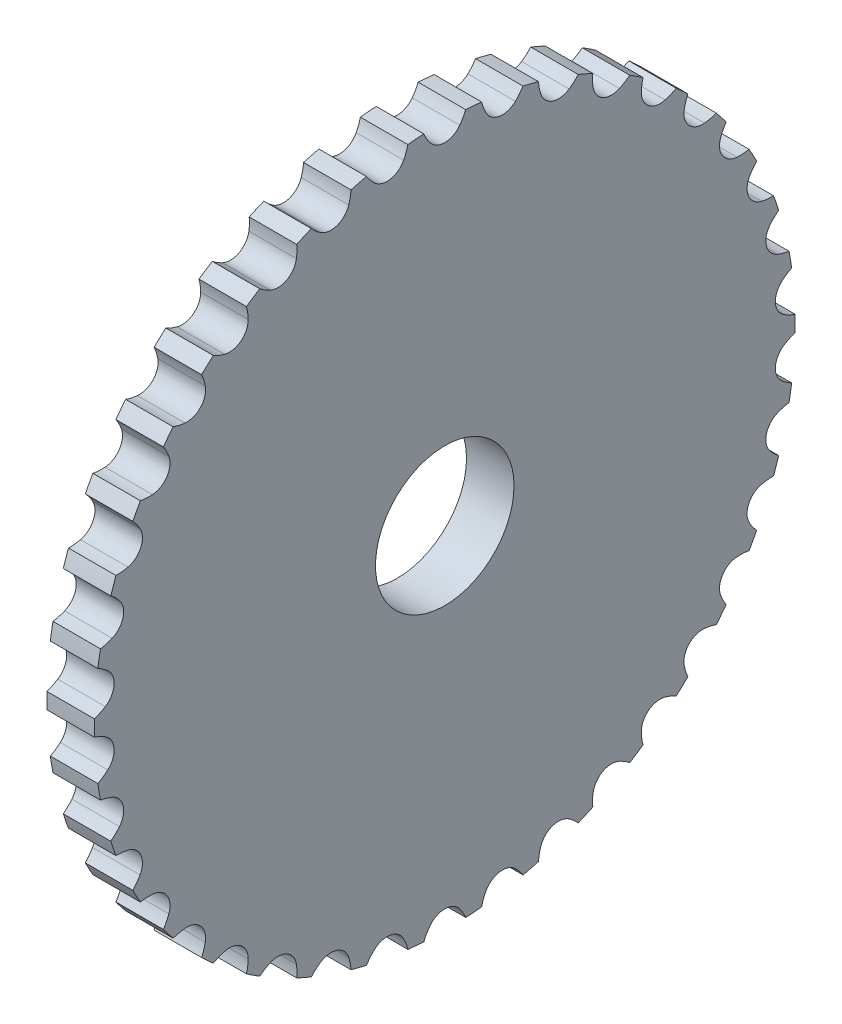
from build123d import *

# Parameters (mm, degrees)
BOSS_EXTRUDE1_DEPTH = 13.030962
SKETCH2_R           = 19
CUT_EXTRUDE1_DEPTH  = 137.435285608


with BuildPart() as part:
    # Sketch1 → Boss-Extrude1 (new body)
    with BuildSketch(Plane(origin=(0, 0, 0), x_dir=(0, 0, -1), z_dir=(1, 0, 0))):
        with BuildLine():
            ThreePointArc((10.112245638, 95.586160258), (7.937491095, 95.79127194), (5.758637096, 95.946910547))
            ThreePointArc((5.758637096, 95.946910547), (5.025601702, 94.455780837), (4.111990682, 93.067932285))
            ThreePointArc((4.111990682, 93.067932285), (0, 90.998929), (-4.111990682, 93.067932285))
            ThreePointArc((-4.111990682, 93.067932285), (-5.025601702, 94.455780837), (-5.758637096, 95.946910547))
            ThreePointArc((-5.758637096, 95.946910547), (-7.937491095, 95.79127194), (-10.112245638, 95.586160258))
            ThreePointArc((-10.112245638, 95.586160258), (-10.589851501, 93.994713954), (-11.262569694, 92.475418415))
            ThreePointArc((-11.262569694, 92.475418415), (-14.977931435, 89.757822217), (-19.374386671, 91.121795572))
            ThreePointArc((-19.374386671, 91.121795572), (-20.503969592, 92.340340247), (-21.472439222, 93.690479231))
            ThreePointArc((-21.472439222, 93.690479231), (-23.59595922, 93.178335751), (-25.707292672, 92.618068692))
            ThreePointArc((-25.707292672, 92.618068692), (-25.916441161, 90.969716299), (-26.329916528, 89.360416196))
            ThreePointArc((-26.329916528, 89.360416196), (-29.547303944, 86.068356024), (-34.108299898, 86.690093813))
            ThreePointArc((-34.108299898, 86.690093813), (-35.423042641, 87.706095889), (-36.600529181, 88.878415875))
            ThreePointArc((-36.600529181, 88.878415875), (-38.610791087, 88.02373746), (-40.601111776, 87.123597649))
            ThreePointArc((-40.601111776, 87.123597649), (-40.536097865, 85.463301925), (-40.679051876, 83.807894769))
            ThreePointArc((-40.679051876, 83.807894769), (-43.310703027, 80.031169443), (-47.911827616, 79.893712278))
            ThreePointArc((-47.911827616, 79.893712278), (-49.375867428, 80.679457867), (-50.730252113, 81.641981022))
            ThreePointArc((-50.730252113, 81.641981022), (-52.572421224, 80.468081072), (-54.38743839, 79.252621976))
            ThreePointArc((-54.38743839, 79.252621976), (-54.05003549, 77.62567146), (-53.918568732, 75.969312443))
            ThreePointArc((-53.918568732, 75.969312443), (-55.892699033, 71.810941186), (-60.408445575, 70.91803854))
            ThreePointArc((-60.408445575, 70.91803854), (-61.981847265, 71.452094551), (-63.476186013, 72.178565752))
            ThreePointArc((-63.476186013, 72.178565752), (-65.100012756, 70.717465197), (-66.690217462, 69.219841372))
            ThreePointArc((-66.690217462, 69.219841372), (-66.089629044, 67.670615032), (-65.687327587, 66.058485311))
            ThreePointArc((-65.687327587, 66.058485311), (-66.950087911, 61.631897649), (-71.257278611, 60.007905581))
            ThreePointArc((-71.257278611, 60.007905581), (-72.897123883, 60.275704356), (-74.490655028, 60.746307364))
            ThreePointArc((-74.490655028, 60.746307364), (-75.851845644, 59.037861218), (-77.17386125, 57.298923938))
            ThreePointArc((-77.17386125, 57.298923938), (-76.3264698, 55.869680631), (-75.66430738, 54.345754901))
            ThreePointArc((-75.66430738, 54.345754901), (-76.181252917, 49.771696608), (-80.16239884, 47.460913386))
            ThreePointArc((-80.16239884, 47.460913386), (-81.82395699, 47.455150074), (-83.473213156, 47.657048064))
            ThreePointArc((-83.473213156, 47.657048064), (-84.534637913, 45.747858285), (-85.55240328, 43.815041227))
            ThreePointArc((-85.55240328, 43.815041227), (-84.481323429, 42.544766984), (-83.57736211, 41.150613967))
            ThreePointArc((-83.57736211, 41.150613967), (-83.334391932, 36.553853428), (-86.880897797, 33.619311195))
            ThreePointArc((-86.880897797, 33.619311195), (-88.518845849, 33.340143005), (-90.178839628, 33.267828726))
            ThreePointArc((-90.178839628, 33.267828726), (-90.911545625, 31.209973034), (-91.597298768, 29.135998408))
            ThreePointArc((-91.597298768, 29.135998408), (-90.331746781, 28.059342999), (-89.210644272, 26.832991555))
            ThreePointArc((-89.210644272, 26.832991555), (-88.214385973, 22.338916415), (-91.229512343, 18.860661833))
            ThreePointArc((-91.229512343, 18.860661833), (-92.799171345, 18.315703745), (-94.424622433, 17.971149743))
            ThreePointArc((-94.424622433, 17.971149743), (-94.808623361, 15.820761077), (-95.143658721, 13.662201504))
            ThreePointArc((-95.143658721, 13.662201504), (-93.718155558, 12.808533282), (-92.410492612, 11.783435082))
            ThreePointArc((-92.410492612, 11.783435082), (-90.688121522, 7.514631995), (-93.08962361, 3.587542783))
            ThreePointArc((-93.08962361, 3.587542783), (-94.548177356, 2.791659833), (-96.094747685, 2.184264642))
            ThreePointArc((-96.094747685, 2.184264642), (-96.119569, 0), (-96.094747685, -2.184264642))
            ThreePointArc((-96.094747685, -2.184264642), (-94.548177356, -2.791659833), (-93.08962361, -3.587542783))
            ThreePointArc((-93.08962361, -3.587542783), (-90.688121522, -7.514631996), (-92.410492612, -11.783435082))
            ThreePointArc((-92.410492612, -11.783435082), (-93.718155558, -12.808533282), (-95.143658721, -13.662201504))
            ThreePointArc((-95.143658721, -13.662201504), (-94.808623361, -15.820761078), (-94.424622433, -17.971149743))
            ThreePointArc((-94.424622433, -17.971149743), (-92.799171345, -18.315703745), (-91.229512343, -18.860661833))
            ThreePointArc((-91.229512343, -18.860661833), (-88.214385973, -22.338916415), (-89.210644272, -26.832991555))
            ThreePointArc((-89.210644272, -26.832991555), (-90.331746781, -28.059342999), (-91.597298768, -29.135998408))
            ThreePointArc((-91.597298768, -29.135998408), (-90.911545625, -31.209973035), (-90.178839628, -33.267828726))
            ThreePointArc((-90.178839628, -33.267828726), (-88.518845849, -33.340143005), (-86.880897797, -33.619311195))
            ThreePointArc((-86.880897797, -33.619311195), (-83.334391932, -36.553853428), (-83.57736211, -41.150613967))
            ThreePointArc((-83.57736211, -41.150613967), (-84.481323429, -42.544766984), (-85.55240328, -43.815041227))
            ThreePointArc((-85.55240328, -43.815041227), (-84.534637913, -45.747858285), (-83.473213156, -47.657048064))
            ThreePointArc((-83.473213156, -47.657048064), (-81.82395699, -47.455150074), (-80.16239884, -47.460913386))
            ThreePointArc((-80.16239884, -47.460913386), (-76.181252917, -49.771696608), (-75.66430738, -54.345754901))
            ThreePointArc((-75.66430738, -54.345754901), (-76.3264698, -55.869680631), (-77.17386125, -57.298923939))
            ThreePointArc((-77.17386125, -57.298923939), (-75.851845644, -59.037861218), (-74.490655027, -60.746307364))
            ThreePointArc((-74.490655027, -60.746307364), (-72.897123883, -60.275704356), (-71.257278611, -60.007905581))
            ThreePointArc((-71.257278611, -60.007905581), (-66.950087911, -61.631897649), (-65.687327587, -66.058485311))
            ThreePointArc((-65.687327587, -66.058485311), (-66.089629044, -67.670615033), (-66.690217462, -69.219841372))
            ThreePointArc((-66.690217462, -69.219841372), (-65.100012756, -70.717465197), (-63.476186013, -72.178565752))
            ThreePointArc((-63.476186013, -72.178565752), (-61.981847265, -71.452094551), (-60.408445575, -70.91803854))
            ThreePointArc((-60.408445575, -70.91803854), (-55.892699033, -71.810941186), (-53.918568732, -75.969312443))
            ThreePointArc((-53.918568732, -75.969312443), (-54.05003549, -77.62567146), (-54.38743839, -79.252621976))
            ThreePointArc((-54.38743839, -79.252621976), (-52.572421224, -80.468081072), (-50.730252113, -81.641981022))
            ThreePointArc((-50.730252113, -81.641981022), (-49.375867428, -80.679457867), (-47.911827616, -79.893712278))
            ThreePointArc((-47.911827616, -79.893712278), (-43.310703027, -80.031169443), (-40.679051876, -83.807894769))
            ThreePointArc((-40.679051876, -83.807894769), (-40.536097865, -85.463301925), (-40.601111776, -87.123597649))
            ThreePointArc((-40.601111776, -87.123597649), (-38.610791087, -88.02373746), (-36.60052918, -88.878415875))
            ThreePointArc((-36.60052918, -88.878415875), (-35.423042641, -87.706095889), (-34.108299898, -86.690093813))
            ThreePointArc((-34.108299898, -86.690093813), (-29.547303944, -86.068356024), (-26.329916528, -89.360416196))
            ThreePointArc((-26.329916528, -89.360416196), (-25.916441161, -90.969716299), (-25.707292672, -92.618068692))
            ThreePointArc((-25.707292672, -92.618068692), (-23.59595922, -93.178335751), (-21.472439222, -93.690479231))
            ThreePointArc((-21.472439222, -93.690479231), (-20.503969592, -92.340340247), (-19.374386671, -91.121795572))
            ThreePointArc((-19.374386671, -91.121795572), (-14.977931435, -89.757822217), (-11.262569694, -92.475418415))
            ThreePointArc((-11.262569694, -92.475418415), (-10.589851501, -93.994713954), (-10.112245638, -95.586160258))
            ThreePointArc((-10.112245638, -95.586160258), (-7.937491095, -95.79127194), (-5.758637096, -95.946910547))
            ThreePointArc((-5.758637096, -95.946910547), (-5.025601702, -94.455780837), (-4.111990682, -93.067932285))
            ThreePointArc((-4.111990682, -93.067932285), (0, -90.998929), (4.111990682, -93.067932285))
            ThreePointArc((4.111990682, -93.067932285), (5.025601703, -94.455780837), (5.758637096, -95.946910547))
            ThreePointArc((5.758637096, -95.946910547), (7.937491095, -95.79127194), (10.112245639, -95.586160258))
            ThreePointArc((10.112245639, -95.586160258), (10.589851501, -93.994713954), (11.262569694, -92.475418415))
            ThreePointArc((11.262569694, -92.475418415), (14.977931435, -89.757822217), (19.374386671, -91.121795572))
            ThreePointArc((19.374386671, -91.121795572), (20.503969592, -92.340340247), (21.472439222, -93.690479231))
            ThreePointArc((21.472439222, -93.690479231), (23.59595922, -93.178335751), (25.707292673, -92.618068692))
            ThreePointArc((25.707292673, -92.618068692), (25.916441161, -90.969716299), (26.329916528, -89.360416196))
            ThreePointArc((26.329916528, -89.360416196), (29.547303945, -86.068356024), (34.108299898, -86.690093813))
            ThreePointArc((34.108299898, -86.690093813), (35.423042641, -87.706095889), (36.600529181, -88.878415875))
            ThreePointArc((36.600529181, -88.878415875), (38.610791087, -88.02373746), (40.601111776, -87.123597649))
            ThreePointArc((40.601111776, -87.123597649), (40.536097865, -85.463301925), (40.679051876, -83.807894769))
            ThreePointArc((40.679051876, -83.807894769), (43.310703027, -80.031169443), (47.911827616, -79.893712278))
            ThreePointArc((47.911827616, -79.893712278), (49.375867428, -80.679457867), (50.730252113, -81.641981022))
            ThreePointArc((50.730252113, -81.641981022), (52.572421224, -80.468081072), (54.38743839, -79.252621976))
            ThreePointArc((54.38743839, -79.252621976), (54.05003549, -77.62567146), (53.918568732, -75.969312443))
            ThreePointArc((53.918568732, -75.969312443), (55.892699033, -71.810941186), (60.408445575, -70.91803854))
            ThreePointArc((60.408445575, -70.91803854), (61.981847265, -71.452094551), (63.476186013, -72.178565752))
            ThreePointArc((63.476186013, -72.178565752), (65.100012756, -70.717465197), (66.690217462, -69.219841372))
            ThreePointArc((66.690217462, -69.219841372), (66.089629044, -67.670615032), (65.687327587, -66.058485311))
            ThreePointArc((65.687327587, -66.058485311), (66.950087911, -61.631897649), (71.257278611, -60.007905581))
            ThreePointArc((71.257278611, -60.007905581), (72.897123883, -60.275704356), (74.490655028, -60.746307364))
            ThreePointArc((74.490655028, -60.746307364), (75.851845644, -59.037861218), (77.17386125, -57.298923938))
            ThreePointArc((77.17386125, -57.298923938), (76.3264698, -55.869680631), (75.66430738, -54.345754901))
            ThreePointArc((75.66430738, -54.345754901), (76.181252917, -49.771696608), (80.16239884, -47.460913386))
            ThreePointArc((80.16239884, -47.460913386), (81.82395699, -47.455150074), (83.473213156, -47.657048064))
            ThreePointArc((83.473213156, -47.657048064), (84.534637913, -45.747858285), (85.55240328, -43.815041227))
            ThreePointArc((85.55240328, -43.815041227), (84.481323429, -42.544766984), (83.57736211, -41.150613967))
            ThreePointArc((83.57736211, -41.150613967), (83.334391932, -36.553853428), (86.880897797, -33.619311195))
            ThreePointArc((86.880897797, -33.619311195), (88.518845849, -33.340143005), (90.178839628, -33.267828726))
            ThreePointArc((90.178839628, -33.267828726), (90.911545625, -31.209973034), (91.597298768, -29.135998408))
            ThreePointArc((91.597298768, -29.135998408), (90.331746781, -28.059342999), (89.210644272, -26.832991555))
            ThreePointArc((89.210644272, -26.832991555), (88.214385973, -22.338916415), (91.229512343, -18.860661833))
            ThreePointArc((91.229512343, -18.860661833), (92.799171345, -18.315703745), (94.424622433, -17.971149743))
            ThreePointArc((94.424622433, -17.971149743), (94.808623361, -15.820761077), (95.143658721, -13.662201504))
            ThreePointArc((95.143658721, -13.662201504), (93.718155558, -12.808533282), (92.410492612, -11.783435082))
            ThreePointArc((92.410492612, -11.783435082), (90.688121522, -7.514631995), (93.089623611, -3.587542783))
            ThreePointArc((93.089623611, -3.587542783), (94.548177356, -2.791659833), (96.094747685, -2.184264642))
            ThreePointArc((96.094747685, -2.184264642), (96.113363471, -1.092202834), (96.119569, 0))
            ThreePointArc((96.119569, 0), (96.113363471, 1.092202834), (96.094747685, 2.184264642))
            ThreePointArc((96.094747685, 2.184264642), (94.548177356, 2.791659833), (93.089623611, 3.587542783))
            ThreePointArc((93.089623611, 3.587542783), (90.688121522, 7.514631996), (92.410492612, 11.783435082))
            ThreePointArc((92.410492612, 11.783435082), (93.718155558, 12.808533282), (95.143658721, 13.662201504))
            ThreePointArc((95.143658721, 13.662201504), (94.808623361, 15.820761078), (94.424622433, 17.971149743))
            ThreePointArc((94.424622433, 17.971149743), (92.799171345, 18.315703745), (91.229512343, 18.860661833))
            ThreePointArc((91.229512343, 18.860661833), (88.214385973, 22.338916415), (89.210644272, 26.832991555))
            ThreePointArc((89.210644272, 26.832991555), (90.331746781, 28.059342999), (91.597298768, 29.135998408))
            ThreePointArc((91.597298768, 29.135998408), (90.911545625, 31.209973034), (90.178839628, 33.267828726))
            ThreePointArc((90.178839628, 33.267828726), (88.518845849, 33.340143005), (86.880897797, 33.619311195))
            ThreePointArc((86.880897797, 33.619311195), (83.334391932, 36.553853428), (83.57736211, 41.150613967))
            ThreePointArc((83.57736211, 41.150613967), (84.481323429, 42.544766984), (85.55240328, 43.815041227))
            ThreePointArc((85.55240328, 43.815041227), (84.534637913, 45.747858285), (83.473213156, 47.657048064))
            ThreePointArc((83.473213156, 47.657048064), (81.82395699, 47.455150074), (80.16239884, 47.460913386))
            ThreePointArc((80.16239884, 47.460913386), (76.181252917, 49.771696608), (75.66430738, 54.345754901))
            ThreePointArc((75.66430738, 54.345754901), (76.3264698, 55.869680631), (77.17386125, 57.298923938))
            ThreePointArc((77.17386125, 57.298923938), (75.851845644, 59.037861218), (74.490655027, 60.746307364))
            ThreePointArc((74.490655027, 60.746307364), (72.897123883, 60.275704356), (71.257278611, 60.007905581))
            ThreePointArc((71.257278611, 60.007905581), (66.950087911, 61.631897649), (65.687327587, 66.058485311))
            ThreePointArc((65.687327587, 66.058485311), (66.089629044, 67.670615033), (66.690217462, 69.219841372))
            ThreePointArc((66.690217462, 69.219841372), (65.100012756, 70.717465197), (63.476186013, 72.178565752))
            ThreePointArc((63.476186013, 72.178565752), (61.981847265, 71.452094551), (60.408445575, 70.91803854))
            ThreePointArc((60.408445575, 70.91803854), (55.892699033, 71.810941186), (53.918568732, 75.969312443))
            ThreePointArc((53.918568732, 75.969312443), (54.05003549, 77.62567146), (54.38743839, 79.252621976))
            ThreePointArc((54.38743839, 79.252621976), (52.572421224, 80.468081072), (50.730252113, 81.641981022))
            ThreePointArc((50.730252113, 81.641981022), (49.375867428, 80.679457867), (47.911827616, 79.893712278))
            ThreePointArc((47.911827616, 79.893712278), (43.310703027, 80.031169443), (40.679051876, 83.807894769))
            ThreePointArc((40.679051876, 83.807894769), (40.536097865, 85.463301925), (40.601111776, 87.123597649))
            ThreePointArc((40.601111776, 87.123597649), (38.610791087, 88.02373746), (36.60052918, 88.878415875))
            ThreePointArc((36.60052918, 88.878415875), (35.423042641, 87.706095889), (34.108299898, 86.690093813))
            ThreePointArc((34.108299898, 86.690093813), (29.547303944, 86.068356025), (26.329916528, 89.360416196))
            ThreePointArc((26.329916528, 89.360416196), (25.916441161, 90.969716299), (25.707292672, 92.618068692))
            ThreePointArc((25.707292672, 92.618068692), (23.59595922, 93.178335751), (21.472439222, 93.690479231))
            ThreePointArc((21.472439222, 93.690479231), (20.503969592, 92.340340247), (19.374386671, 91.121795572))
            ThreePointArc((19.374386671, 91.121795572), (14.977931435, 89.757822217), (11.262569694, 92.475418415))
            ThreePointArc((11.262569694, 92.475418415), (10.589851501, 93.994713954), (10.112245638, 95.586160258))
        make_face()
    extrude(amount=BOSS_EXTRUDE1_DEPTH)

    # Sketch2 → Cut-Extrude1 (cut, through all)
    with BuildSketch(Plane(origin=(13.030962, 0, 0), x_dir=(0, 0, -1), z_dir=(1, 0, 0))):
        Circle(SKETCH2_R)
    extrude(amount=-CUT_EXTRUDE1_DEPTH, mode=Mode.SUBTRACT)


solid = part.part
